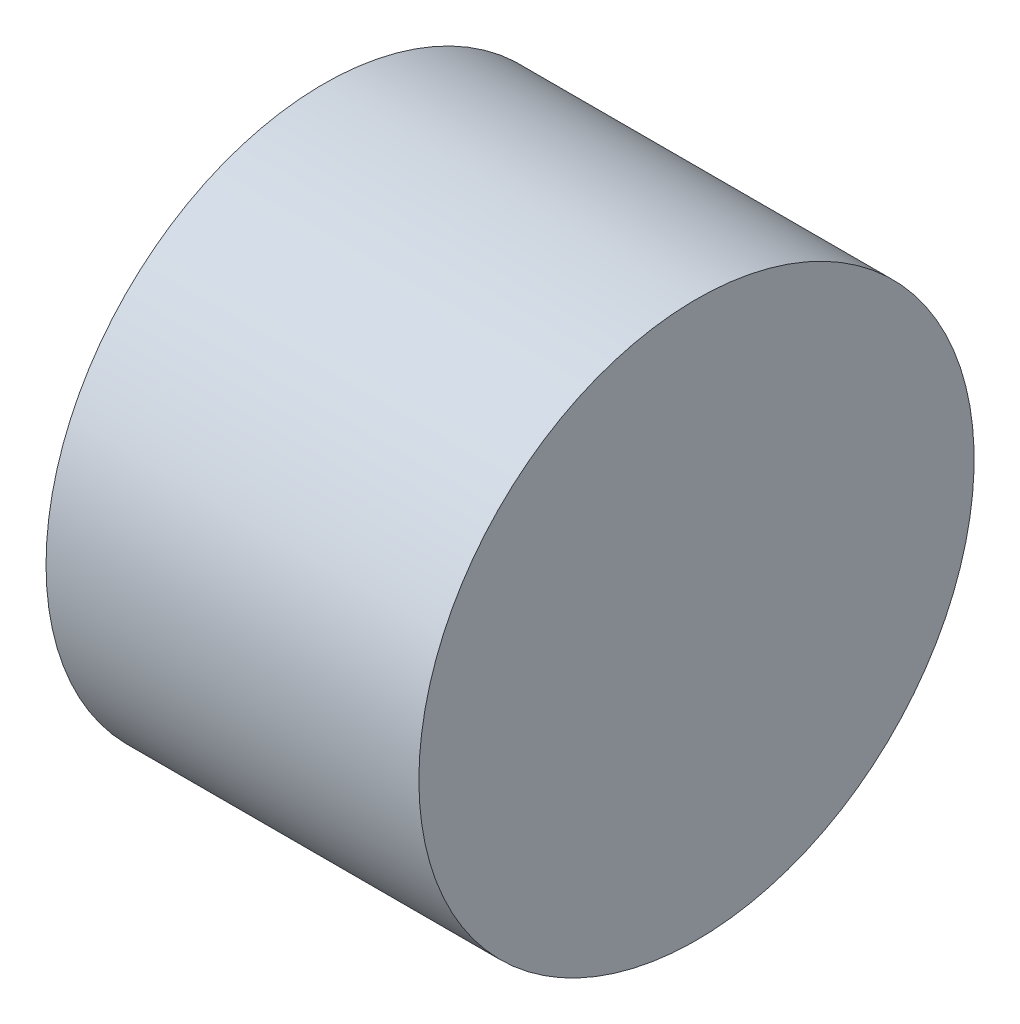
from build123d import *


with BuildPart() as part:
    # Sketch1 → Revolve7 (revolve)
    with BuildSketch(Plane(origin=(0, 0, 0), x_dir=(1, 0, 0), z_dir=(0, 1, 0)), mode=Mode.PRIVATE) as revolve7_sk:
        with BuildLine():
            Line((17.5, 17.5), (-6, 17.5))
            Line((-6, 17.5), (-6, 10.392304845))
            ThreePointArc((-6, 10.392304845), (6, 10.392304845), (12, 0))
            Line((12, 0), (17.5, 0))
            Line((17.5, 0), (17.5, 17.5))
        make_face()
    revolve(revolve7_sk.sketch.rotate(Axis((-27.647764471, 0, 0), (1, 0, 0)), 180), axis=Axis((-27.647764471, 0, 0), (1, 0, 0)))


solid = part.part
